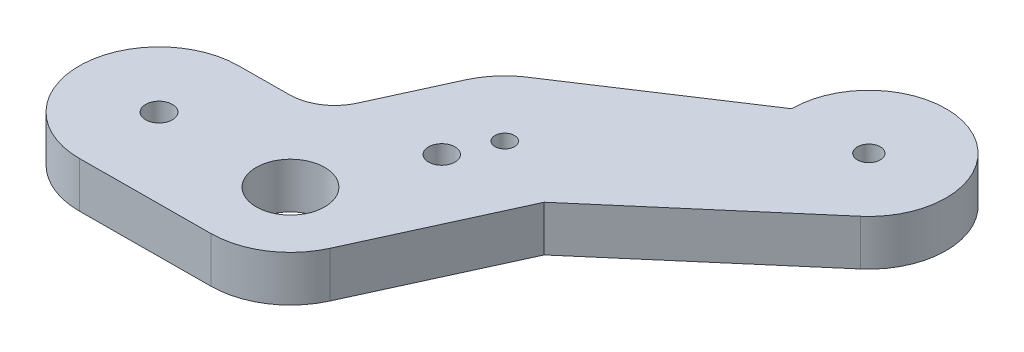
from build123d import *

# Parameters (mm, degrees)
SKETCH1_R           = 1.5
SKETCH1_R_2         = 0.586127488
SKETCH1_R_3         = 0.42585763
BOSS_EXTRUDE1_DEPTH = 2
SKETCH3_R           = 0.579621875
CUT_EXTRUDE1_DEPTH  = 2
SKETCH4_R           = 0.5
BOSS_EXTRUDE3_DEPTH = 2


with BuildPart() as part:
    # Sketch1 → Boss-Extrude1 (new body)
    with BuildSketch(Plane(origin=(0, 0, 0), x_dir=(1, 0, 0), z_dir=(0, 1, 0))):
        with BuildLine():
            Line((-5.704810184, -3.532312602), (0.0197897, -3.499944052))
            ThreePointArc((0.0197897, -3.499944052), (1.899950502, -2.939419686), (3.183109291, -1.455271536))
            Line((3.183109291, -1.455271536), (6.127465187, 4.984905694))
            ThreePointArc((6.127465187, 4.984905694), (4.399627432, 9.62328652), (-0.238753394, 7.895448766))
            Line((-0.238753394, 7.895448766), (-1.72322244, 4.648475885))
            ThreePointArc((-1.72322244, 4.648475885), (-2.456456033, 3.800391228), (-3.530833635, 3.48009159))
            Line((-3.530833635, 3.48009159), (-5.744389584, 3.467575502))
            ThreePointArc((-5.744389584, 3.467575502), (-9.224543936, -0.05215825), (-5.704810184, -3.532312602))
        make_face()
        with Locations(Location((0, 0, 0), (0, 0, 270))):
            Circle(SKETCH1_R, mode=Mode.SUBTRACT)
        with Locations(Location((-5.724599884, -0.03236855, 0), (0, 0, 270))):
            Circle(SKETCH1_R_2, mode=Mode.SUBTRACT)
        with Locations(Location((2.944355896, 6.44017723, 0), (0, 0, 270))):
            Circle(SKETCH1_R_3, mode=Mode.SUBTRACT)
    extrude(amount=BOSS_EXTRUDE1_DEPTH)

    # Sketch3 → Cut-Extrude1 (cut)
    with BuildSketch(Plane(origin=(0, 2, 0), x_dir=(1, 0, 0), z_dir=(0, 1, 0))):
        with Locations(Location((2.073730064, 4.551378241, 0), (0, 0, 270))):
            Circle(SKETCH3_R)
    extrude(amount=-CUT_EXTRUDE1_DEPTH, mode=Mode.SUBTRACT)

    # Sketch4 → Boss-Extrude3 (add)
    with BuildSketch(Plane(origin=(0, 2, 0), x_dir=(1, 0, 0), z_dir=(0, 1, 0))):
        with BuildLine():
            Line((13.583389447, 11.376075771), (6.127465187, 4.984905694))
            Line((6.127465187, 4.984905694), (0.873997954, 9.262165534))
            Line((0.873997954, 9.262165534), (7.997134718, 13.945290547))
            ThreePointArc((7.997134718, 13.945290547), (12.795032794, 17.01966473), (13.583389447, 11.376075771))
        make_face()
        with Locations(Location((11.381075149, 13.945290547, 0), (0, 0, 270))):
            Circle(SKETCH4_R, mode=Mode.SUBTRACT)
    extrude(amount=-BOSS_EXTRUDE3_DEPTH)


solid = part.part
